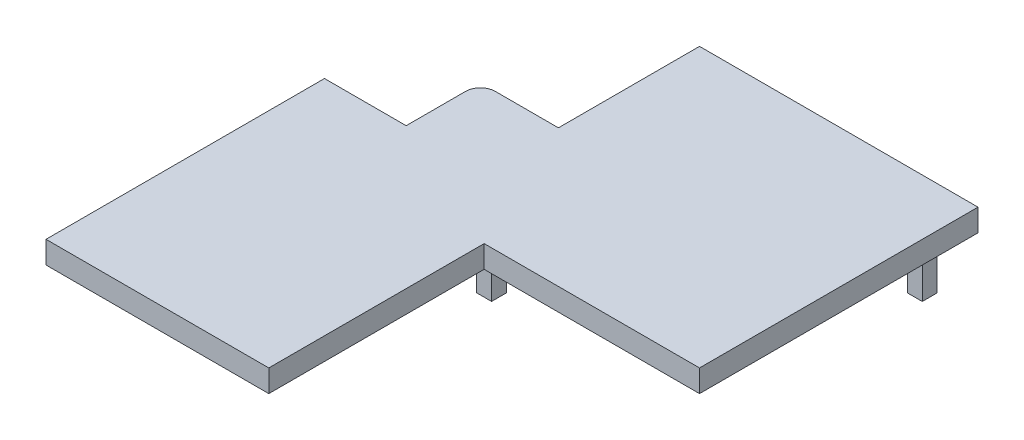
from build123d import *

# Parameters (mm, degrees)
SKETCH1_W            = 5.08
SKETCH1_H            = 5.08
BOSS_EXTRUDE2_DEPTH  = 5.08
BOSS_EXTRUDE7_DEPTH  = 5.08
BOSS_EXTRUDE8_DEPTH  = 1.27
BOSS_EXTRUDE9_DEPTH  = 12.7
BOSS_EXTRUDE10_DEPTH = 12.7
SKETCH1_5_W          = 5.08
SKETCH1_5_H          = 5.08
BOSS_EXTRUDE12_DEPTH = 25.4
BOSS_EXTRUDE13_DEPTH = 2.54
FILLET4_R            = 5.08


with BuildPart() as part:
    # Sketch1 → Boss-Extrude2 (new body)
    with BuildSketch(Plane(origin=(0, 0, 0), x_dir=(1, 0, 0), z_dir=(0, 1, 0))):
        Polygon((1.79979496, -9.735410081), (75.45979496, -9.735410081), (75.45979496, 85.514589919), (-19.79020504, 85.514589919), (-19.79020504, 34.079589919), (18.30979496, 34.079589919), (19.57979496, 34.079589919), (24.02479496, 34.079589919), (25.29479496, 34.079589919), (29.73979496, 34.079589919), (31.00979496, 34.079589919), (43.70979496, 34.079589919), (44.97979496, 34.079589919), (49.42479496, 34.079589919), (50.69479496, 34.079589919), (55.13979496, 34.079589919), (56.40979496, 34.079589919), (56.40979496, 21.379589919), (55.13979496, 21.379589919), (50.69479496, 21.379589919), (49.42479496, 21.379589919), (44.97979496, 21.379589919), (43.70979496, 21.379589919), (31.00979496, 21.379589919), (29.73979496, 21.379589919), (25.29479496, 21.379589919), (24.02479496, 21.379589919), (19.57979496, 21.379589919), (18.30979496, 21.379589919), (-19.79020504, 21.379589919), (-19.79020504, 11.854589919), (-30.58520504, 11.854589919), (-30.58520504, -28.571024106), (-30.58520504, -41.271024106), (-30.58520504, -42.755410081), (-30.58520504, -55.455410081), (-31.85520504, -55.455410081), (-36.30020504, -55.455410081), (-37.57020504, -55.455410081), (-42.01520504, -55.455410081), (-43.28520504, -55.455410081), (-43.28520504, -42.755410081), (-43.28520504, -41.271024106), (-43.28520504, -28.571024106), (-43.28520504, 11.854589919), (-74.40020504, 11.854589919), (-74.40020504, -83.395410081), (1.79979496, -83.395410081), align=None)
        with Locations((-7.72520504, 2.329589919)):
            Rectangle(SKETCH1_W, SKETCH1_H, mode=Mode.SUBTRACT)
        with Locations((-7.72520504, 75.989589919)):
            Rectangle(SKETCH1_W, SKETCH1_H, mode=Mode.SUBTRACT)
        with Locations((65.942961522, 75.973256793)):
            Rectangle(SKETCH1_W, SKETCH1_H, mode=Mode.SUBTRACT)
    extrude(amount=-BOSS_EXTRUDE2_DEPTH)

    # Sketch4 → Boss-Extrude7 (add)
    with BuildSketch(Plane(origin=(0, 0, 0), x_dir=(1, 0, 0), z_dir=(0, 1, 0))):
        Polygon((-46.46020504, 11.854589919), (-43.28520504, 11.854589919), (-43.28520504, 34.079589919), (-19.79020504, 34.079589919), (-19.79020504, 37.254589919), (-46.46020504, 37.254589919), align=None)
    extrude(amount=-BOSS_EXTRUDE7_DEPTH)



with BuildPart() as body_2:
    # Sketch4<5> → Boss-Extrude8 (new body)
    with BuildSketch(Plane(origin=(0, 0, 0), x_dir=(1, 0, 0), z_dir=(0, 1, 0))):
        Polygon((-30.58520504, 11.854589919), (-19.79020504, 11.854589919), (-19.79020504, 21.379589919), (-19.79020504, 34.079589919), (-43.28520504, 34.079589919), (-43.28520504, 11.854589919), align=None)
    extrude(amount=-BOSS_EXTRUDE8_DEPTH)


with BuildPart() as part_1:
    add(part.part)

    add(body_2.part)  # Boss-Extrude9 merges body 2
    # Sketch5 → Boss-Extrude9 (add)
    with BuildSketch(Plane.ZY.offset(30.58520504)):
        Polygon((55.455410081, -5.08), (55.455410081, 0), (-11.854589919, 0), (-11.854589919, -1.279733849), align=None)
    extrude(amount=BOSS_EXTRUDE9_DEPTH)

    # Sketch6 → Boss-Extrude10 (add)
    with BuildSketch(Plane.XY.offset(-34.079589919)):
        Polygon((56.40979496, -5.08), (56.40979496, 0), (-19.79020504, 0), (-19.79020504, -1.27), align=None)
    extrude(amount=BOSS_EXTRUDE10_DEPTH)

    # Sketch1<5> → Boss-Extrude12 (add)
    with BuildSketch(Plane(origin=(0, 0, 0), x_dir=(1, 0, 0), z_dir=(0, 1, 0))):
        with Locations((-7.72520504, 2.329589919)):
            Rectangle(SKETCH1_5_W, SKETCH1_5_H)
        with Locations((-7.72520504, 75.989589919)):
            Rectangle(SKETCH1_5_W, SKETCH1_5_H)
        with Locations((65.942961522, 75.973256793)):
            Rectangle(SKETCH1_5_W, SKETCH1_5_H)
    extrude(amount=-BOSS_EXTRUDE12_DEPTH)

    # Sketch7 → Boss-Extrude13 (add)
    with BuildSketch(Plane.XZ.offset(5.08)):
        Polygon((-74.40020504, -11.854589919), (-46.46020504, -11.854589919), (-46.46020504, -37.254589919), (-19.79020504, -37.254589919), (-19.79020504, -85.514589919), (75.45979496, -85.514589919), (75.45979496, 9.735410081), (1.79979496, 9.735410081), (1.79979496, 83.395410081), (-74.40020504, 83.395410081), align=None)
        Polygon((-30.58520504, 55.455410081), (-43.28520504, 55.455410081), (-43.28520504, -34.079589919), (56.40979496, -34.079589919), (56.40979496, -21.379589919), (-19.79020504, -21.379589919), (-19.79020504, -11.854589919), (-30.58520504, -11.854589919), align=None, mode=Mode.SUBTRACT)
    extrude(amount=BOSS_EXTRUDE13_DEPTH)

    # Fillet4
    fillet4_edges = [part_1.edges().sort_by_distance(p)[0] for p in [
        (-19.79020504, -4.445, -11.854589919),
        (-43.28520504, -4.445, -34.079589919),
        (-46.46020504, -3.81, -37.254589919),
    ]]
    fillet(fillet4_edges, radius=FILLET4_R)


solid = part_1.part
